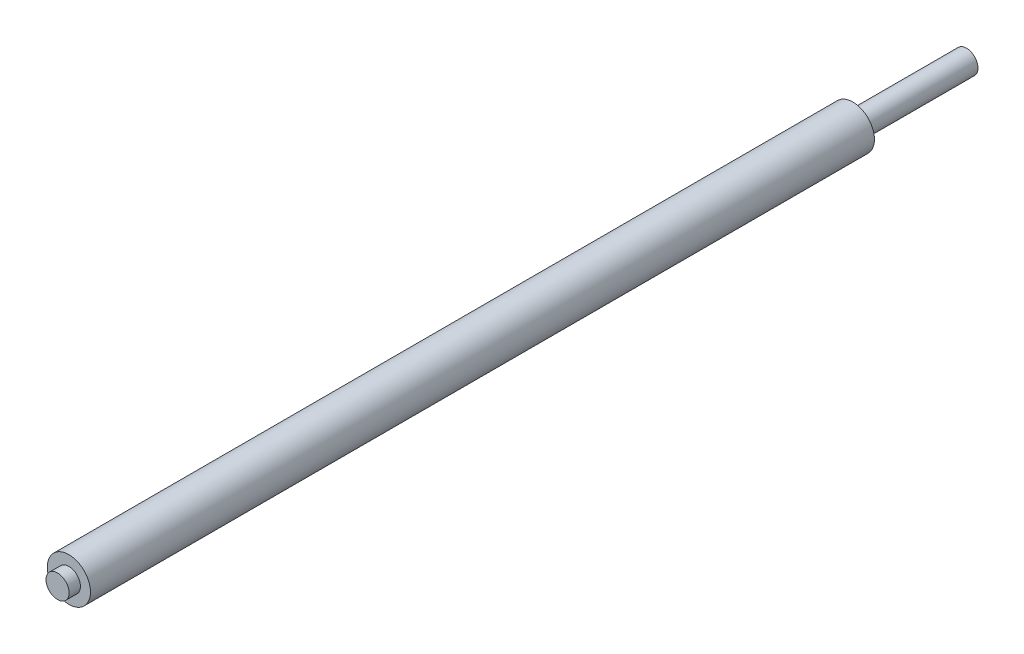
from build123d import *

# Parameters (mm, degrees)
SKETCH_1_R           = 0.1016
EXTRUDE_1_DEPTH      = 4
EXTRUDE_2_DEPTH      = 3.9
EXTRUDE_2_DEPTH_BACK = 3
SKETCH_2_R           = 0.19


with BuildPart() as part:
    # 草图1 → 凸台-拉伸1 (new, symmetric)
    with BuildSketch(Plane.XY):
        Circle(SKETCH_1_R)
    extrude(amount=EXTRUDE_1_DEPTH, both=True)

    # 草图2 → 凸台-拉伸2 (add, two sides: drawn at the far end of the back side and taken through both)
    with BuildSketch(Plane.XY.offset(-EXTRUDE_2_DEPTH_BACK)):
        with Locations((0, 0.001129958)):
            Circle(SKETCH_2_R)
    extrude(amount=EXTRUDE_2_DEPTH + EXTRUDE_2_DEPTH_BACK)


solid = part.part
